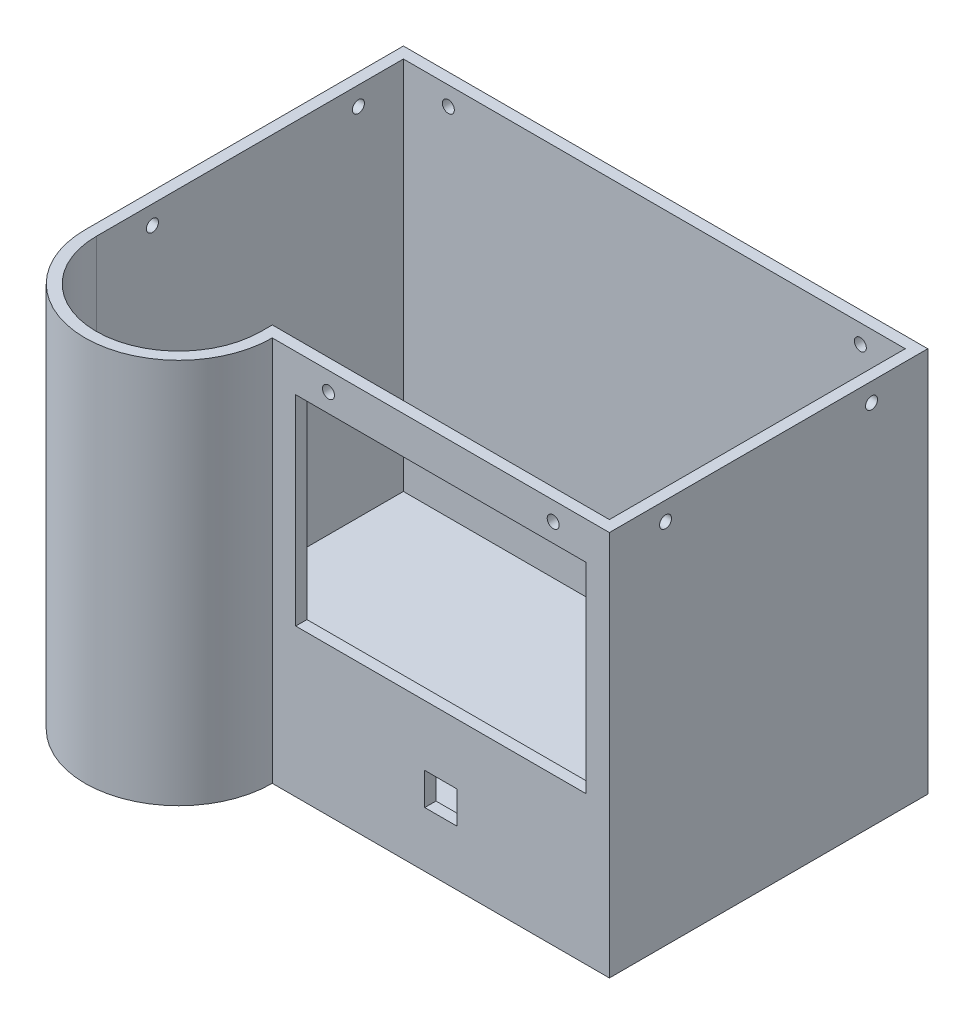
from build123d import *

# Parameters (mm, degrees)
IZIM1_R                     = 13.8
Y_KSEKLIK_EKSTR_ZYON1_DEPTH = 3
Y_KSEKLIK_EKSTR_ZYON2_DEPTH = 100
IZIM3_W                     = 77.5
IZIM3_H                     = 53.5
KES_EKSTR_ZYON1_DEPTH       = 10
IZIM4_W                     = 8.6
IZIM4_H                     = 8.6
KES_EKSTR_ZYON2_DEPTH       = 10
IZIM5_R                     = 1.6
KES_EKSTR_ZYON3_DEPTH       = 10
IZIM6_R                     = 1.6
KES_EKSTR_ZYON4_DEPTH       = 10
KES_EKSTR_ZYON5_START       = -10
IZIM7_R                     = 1.6
KES_EKSTR_ZYON5_DEPTH       = 10
KES_EKSTR_ZYON6_START       = -10
IZIM8_R                     = 1.6
KES_EKSTR_ZYON6_DEPTH       = 10


with BuildPart() as part:
    # Çizim1 → Yükseklik-Ekstrüzyon1 (new body)
    with BuildSketch(Plane(origin=(0, 0, 0), x_dir=(1, 0, 0), z_dir=(0, 1, 0))):
        with BuildLine():
            Line((50, 0), (140, 0))
            Line((140, 0), (140, 85))
            Line((140, 85), (0, 85))
            Line((0, 85), (0, 0))
            ThreePointArc((0, 0), (25, -25), (50, 0))
        make_face()
        with Locations(Location((25, 0, 0), (0, 0, 270))):
            Circle(IZIM1_R, mode=Mode.SUBTRACT)
    extrude(amount=Y_KSEKLIK_EKSTR_ZYON1_DEPTH)

    # Çizim2 → Yükseklik-Ekstrüzyon2 (add)
    with BuildSketch(Plane(origin=(0, 3, 0), x_dir=(1, 0, 0), z_dir=(0, 1, 0))):
        with BuildLine():
            Line((140, 85), (0, 85))
            Line((0, 85), (0, 0))
            ThreePointArc((0, 0), (25, -25), (50, 0))
            Line((50, 0), (140, 0))
            Line((140, 0), (140, 85))
        make_face()
        with BuildLine():
            Line((3, 0), (3, 3))
            Line((3, 3), (3, 82))
            Line((3, 82), (137, 82))
            Line((137, 82), (137, 3))
            Line((137, 3), (47, 3))
            Line((47, 3), (47, 0))
            ThreePointArc((47, 0), (25, -22), (3, 0))
        make_face(mode=Mode.SUBTRACT)
    extrude(amount=Y_KSEKLIK_EKSTR_ZYON2_DEPTH)

    # Çizim3 → Kes-Ekstrüzyon1 (cut)
    with BuildSketch(Plane.XY):
        with Locations((95, 66.25)):
            Rectangle(IZIM3_W, IZIM3_H)
    extrude(amount=-KES_EKSTR_ZYON1_DEPTH, mode=Mode.SUBTRACT)

    # Çizim4 → Kes-Ekstrüzyon2 (cut)
    with BuildSketch(Plane.XY):
        with Locations((95, 19.062)):
            Rectangle(IZIM4_W, IZIM4_H)
    extrude(amount=-KES_EKSTR_ZYON2_DEPTH, mode=Mode.SUBTRACT)

    # Çizim5 → Kes-Ekstrüzyon3 (cut)
    with BuildSketch(Plane.XY):
        with Locations((65, 98)):
            Circle(IZIM5_R)
        with Locations((125, 98)):
            Circle(IZIM5_R)
    extrude(amount=-KES_EKSTR_ZYON3_DEPTH, mode=Mode.SUBTRACT)

    # Çizim6 → Kes-Ekstrüzyon4 (cut)
    with BuildSketch(Plane(origin=(140, 0, 0), x_dir=(0, 0, -1), z_dir=(1, 0, 0))):
        with Locations((15, 98)):
            Circle(IZIM6_R)
        with Locations((70, 98)):
            Circle(IZIM6_R)
    extrude(amount=-KES_EKSTR_ZYON4_DEPTH, mode=Mode.SUBTRACT)

    # Çizim7 → Kes-Ekstrüzyon5 (cut)
    with BuildSketch(Plane(origin=(0, 0, -85), x_dir=(-1, 0, 0), z_dir=(0, 0, -1)).offset(KES_EKSTR_ZYON5_START)):
        with Locations(Location((-125, 98, 0), (0, 0, 180))):
            Circle(IZIM7_R)
        with Locations((-15, 98)):
            Circle(IZIM7_R)
    extrude(amount=KES_EKSTR_ZYON5_DEPTH, mode=Mode.SUBTRACT)

    # Çizim8 → Kes-Ekstrüzyon6 (cut)
    with BuildSketch(Plane.ZY.offset(KES_EKSTR_ZYON6_START)):
        with Locations(Location((-70, 98, 0), (0, 0, 180))):
            Circle(IZIM8_R)
        with Locations(Location((-15, 98, 0), (0, 0, 180))):
            Circle(IZIM8_R)
    extrude(amount=KES_EKSTR_ZYON6_DEPTH, mode=Mode.SUBTRACT)


solid = part.part
